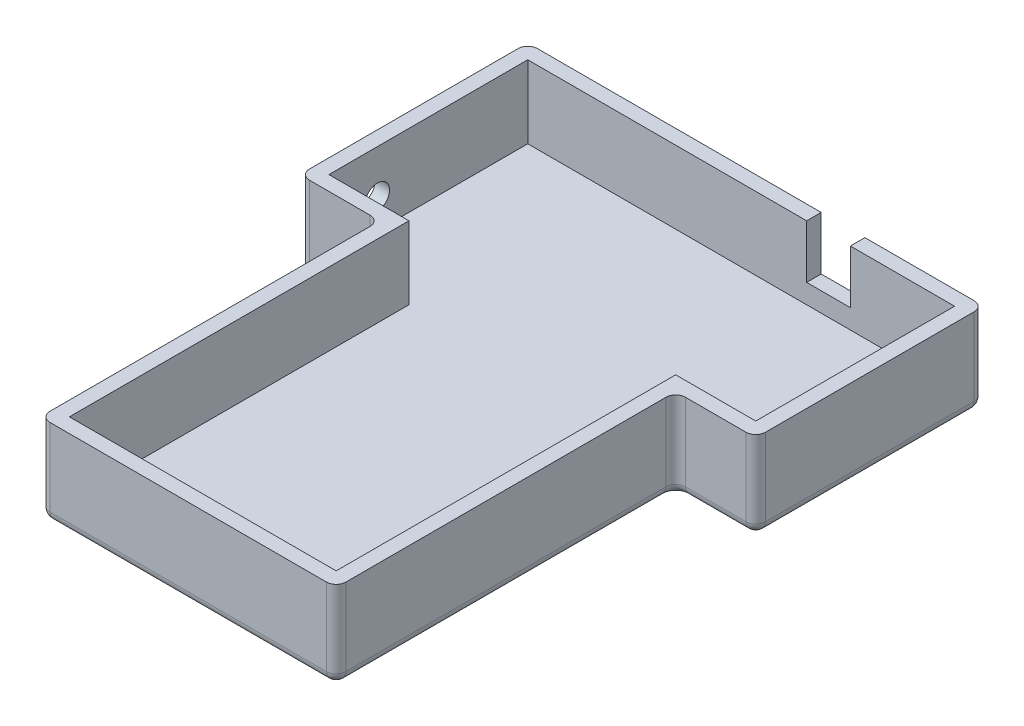
from build123d import *

# Parameters (mm, degrees)
BOSS_EXTRUDE1_DEPTH = 15
SHELL1_T            = 3
SKETCH3_W           = 9
SKETCH3_H           = 11
CUT_EXTRUDE1_DEPTH  = 3
SKETCH4_R           = 2.5
CUT_EXTRUDE2_DEPTH  = 3
FILLET1_R           = 2


with BuildPart() as part:
    # Sketch1 → Boss-Extrude1 (new body)
    with BuildSketch(Plane(origin=(0, 0, 0), x_dir=(1, 0, 0), z_dir=(0, 1, 0))):
        Polygon((0, 0), (88, 0), (88, -41), (71.5, -41), (71.5, -111), (16.5, -111), (16.5, -41), (0, -41), align=None)
    extrude(amount=BOSS_EXTRUDE1_DEPTH)

    # Shell1
    shell1_openings = [part.faces().sort_by_distance(p)[0] for p in [
        (44, 15, 49.150442478),
    ]]
    offset(amount=SHELL1_T, openings=shell1_openings, kind=Kind.INTERSECTION)

    # Sketch3 → Cut-Extrude1 (cut)
    with BuildSketch(Plane(origin=(0, 0, -3), x_dir=(-1, 0, 0), z_dir=(0, 0, -1))):
        with Locations((-62, 9.5)):
            Rectangle(SKETCH3_W, SKETCH3_H)
    extrude(amount=-CUT_EXTRUDE1_DEPTH, mode=Mode.SUBTRACT)

    # Sketch4 → Cut-Extrude2 (cut)
    with BuildSketch(Plane.ZY.offset(3)):
        with Locations((31, 6)):
            Circle(SKETCH4_R)
    extrude(amount=-CUT_EXTRUDE2_DEPTH, mode=Mode.SUBTRACT)

    # Fillet1
    fillet1_edges = [part.edges().sort_by_distance(p)[0] for p in [
        (44, -3, 114),
        (13.5, -3, 79),
        (5.25, -3, 44),
        (-3, -3, 20.5),
        (-3, 6, -3),
        (91, 6, -3),
        (91, 6, 44),
        (74.5, 6, 44),
        (74.5, 6, 114),
        (13.5, 6, 114),
        (13.5, 6, 44),
        (-3, 6, 44),
        (44, -3, -3),
        (91, -3, 20.5),
        (82.75, -3, 44),
        (74.5, -3, 79),
    ]]
    fillet(fillet1_edges, radius=FILLET1_R)


solid = part.part
